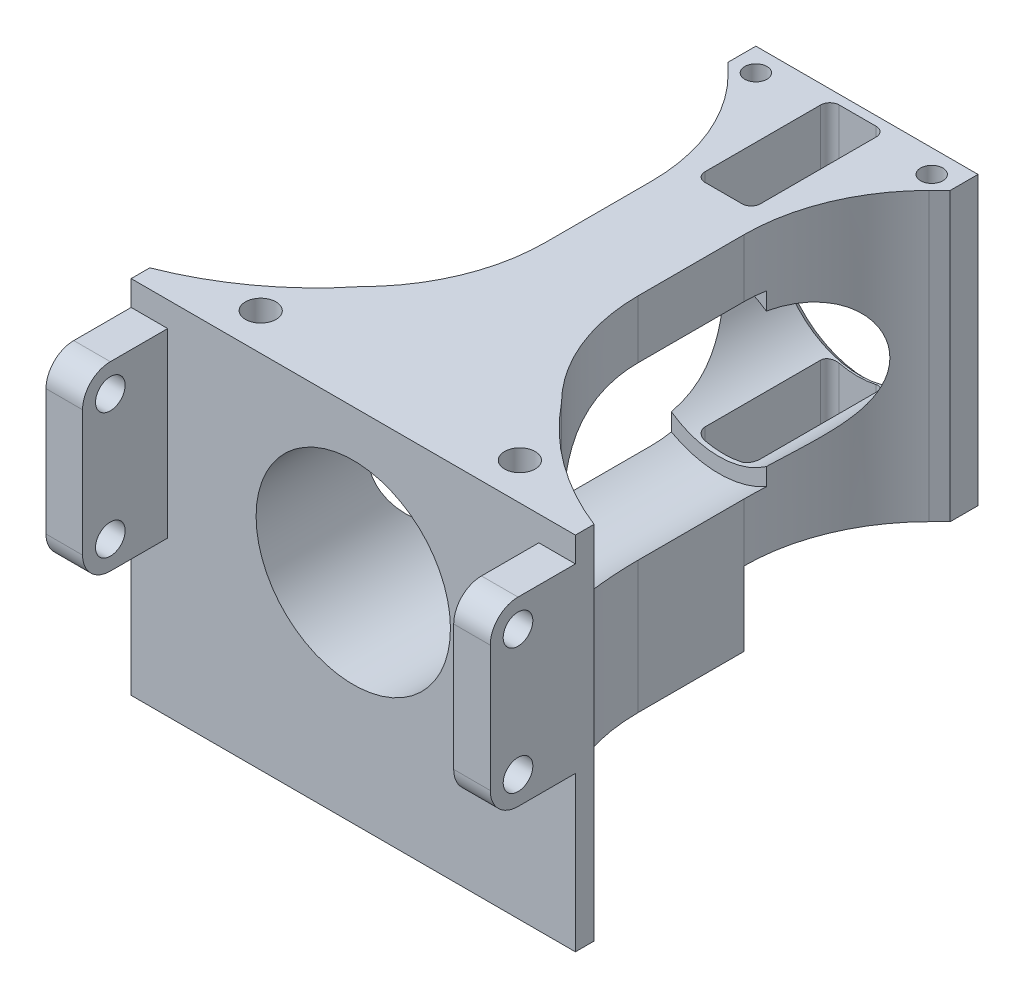
from build123d import *

# Parameters (mm, degrees)
SKETCH_1_W           = 48
SKETCH_1_H           = 31
SKETCH_1_R           = 8.9
EXTRUDE_1_DEPTH      = 65
SKETCH_2_R           = 10.5
CUT_EXTRUDE_1_DEPTH  = 49
CUT_EXTRUDE_3_DEPTH  = 76.907838857
CUT_EXTRUDE_START    = -31
CUT_EXTRUDE_5_DEPTH  = 107.907838984
SKETCH_9_R           = 1.2
CUT_EXTRUDE_6_DEPTH  = 7
CUT_EXTRUDE_START_2  = -24
SKETCH_9_2_R         = 1.2
CUT_EXTRUDE_7_DEPTH  = 7
EXTRUDE_4_DEPTH      = 8
SKETCH_11_R          = 1.65
CUT_EXTRUDE_9_DEPTH  = 80.511005658
SKETCH_14_R          = 1.65
CUT_EXTRUDE_10_DEPTH = 11
SKETCH_15_W          = 40.1
SKETCH_15_H          = 9.5
CUT_EXTRUDE_11_DEPTH = 80.511005658
SKETCH_17_R          = 1.6
CUT_EXTRUDE_13_DEPTH = 85.150163426
SKETCH_19_W          = 3
SKETCH_19_H          = 3
CUT_EXTRUDE_14_DEPTH = 76.651107105
CHAMFER_1_SIZE       = 0.8


with BuildPart() as part:
    # 草图1 → 凸台-拉伸1 (new body)
    with BuildSketch(Plane.XY):
        Rectangle(SKETCH_1_W, SKETCH_1_H)
        Circle(SKETCH_1_R, mode=Mode.SUBTRACT)
    extrude(amount=EXTRUDE_1_DEPTH)

    # 草图2 → 切除-拉伸1 (cut)
    with BuildSketch(Plane.XY.offset(65)):
        Circle(SKETCH_2_R)
    extrude(amount=-CUT_EXTRUDE_1_DEPTH, mode=Mode.SUBTRACT)

    # 草图4 → 切除-拉伸3 (cut, through all)
    with BuildSketch(Plane(origin=(0, 15.5, 0), x_dir=(1, 0, 0), z_dir=(0, 1, 0))):
        with BuildLine():
            Line((-24, 9), (-10.857864376, -4.142135624))
            ThreePointArc((-10.857864376, -4.142135624), (-6.52240935, -10.6306026), (-5, -18.284271247))
            Line((-5, -18.284271247), (-5, -29.715728753))
            ThreePointArc((-5, -29.715728753), (-6.52240935, -37.3693974), (-10.857864376, -43.857864376))
            ThreePointArc((-10.857864376, -43.857864376), (-16.798925034, -49.531146093), (-24, -53.484226727))
            Line((-24, -53.484226727), (-24, 9))
        make_face()
        with BuildLine():
            Line((5, -18.284271247), (5, -29.715728753))
            ThreePointArc((5, -29.715728753), (6.52240935, -37.3693974), (10.857864376, -43.857864376))
            ThreePointArc((10.857864376, -43.857864376), (16.798925034, -49.531146093), (24, -53.484226727))
            Line((24, -53.484226727), (24, 9))
            Line((24, 9), (10.857864376, -4.142135624))
            ThreePointArc((10.857864376, -4.142135624), (6.52240935, -10.6306026), (5, -18.284271247))
        make_face()
    extrude(amount=-CUT_EXTRUDE_3_DEPTH, mode=Mode.SUBTRACT)

    # 草图6 → 切除-拉伸5 (cut, through all)
    with BuildSketch(Plane(origin=(0, 15.5, 0), x_dir=(1, 0, 0), z_dir=(0, 1, 0)).offset(CUT_EXTRUDE_START)):
        with BuildLine():
            Line((-2, -1), (2, -1))
            ThreePointArc((2, -1), (2.707106781, -1.292893219), (3, -2))
            Line((3, -2), (3, -14.5))
            ThreePointArc((3, -14.5), (2.707106781, -15.207106781), (2, -15.5))
            Line((2, -15.5), (-2, -15.5))
            ThreePointArc((-2, -15.5), (-2.707106781, -15.207106781), (-3, -14.5))
            Line((-3, -14.5), (-3, -2))
            ThreePointArc((-3, -2), (-2.707106781, -1.292893219), (-2, -1))
        make_face()
    extrude(amount=CUT_EXTRUDE_5_DEPTH, mode=Mode.SUBTRACT)

    # 草图9 → 切除-拉伸6 (cut)
    with BuildSketch(Plane(origin=(0, 15.5, 0), x_dir=(1, 0, 0), z_dir=(0, 1, 0))):
        with Locations(Location((9.5, -2.5, 0), (0, 0, 270))):
            Circle(SKETCH_9_R)
        with Locations(Location((-9.5, -2.5, 0), (0, 0, 270))):
            Circle(SKETCH_9_R)
    extrude(amount=-CUT_EXTRUDE_6_DEPTH, mode=Mode.SUBTRACT)

    # 草图9<2> → 切除-拉伸7 (cut)
    with BuildSketch(Plane(origin=(0, 15.5, 0), x_dir=(1, 0, 0), z_dir=(0, 1, 0)).offset(CUT_EXTRUDE_START_2)):
        with Locations(Location((9.5, -2.5, 0), (0, 0, 270))):
            Circle(SKETCH_9_2_R)
        with Locations(Location((-9.5, -2.5, 0), (0, 0, 270))):
            Circle(SKETCH_9_2_R)
    extrude(amount=-CUT_EXTRUDE_7_DEPTH, mode=Mode.SUBTRACT)

    # 草图12 → 凸台-拉伸4 (add)
    with BuildSketch(Plane.XZ.offset(15.5)):
        with BuildLine():
            Line((-5, 18.284271247), (5, 18.284271247))
            Line((5, 18.284271247), (5, 29.715728753))
            ThreePointArc((5, 29.715728753), (6.52240935, 37.3693974), (10.857864376, 43.857864376))
            ThreePointArc((10.857864376, 43.857864376), (16.798925034, 49.531146093), (24, 53.484226727))
            Line((24, 53.484226727), (24, 65))
            Line((24, 65), (-24, 65))
            Line((-24, 65), (-24, 53.484226727))
            ThreePointArc((-24, 53.484226727), (-16.798925034, 49.531146093), (-10.857864376, 43.857864376))
            ThreePointArc((-10.857864376, 43.857864376), (-6.52240935, 37.3693974), (-5, 29.715728753))
            Line((-5, 29.715728753), (-5, 18.284271247))
        make_face()
    extrude(amount=EXTRUDE_4_DEPTH)

    # 草图11 → 切除-拉伸9 (cut, through all)
    with BuildSketch(Plane(origin=(0, 15.5, 0), x_dir=(1, 0, 0), z_dir=(0, 1, 0))):
        with Locations(Location((14, -51.5, 0), (0, 0, 270))):
            Circle(SKETCH_11_R)
        with Locations(Location((-14, -51.5, 0), (0, 0, 270))):
            Circle(SKETCH_11_R)
    extrude(amount=-CUT_EXTRUDE_9_DEPTH, mode=Mode.SUBTRACT)

    # 草图14 → 切除-拉伸10 (cut)
    with BuildSketch(Plane.XZ.offset(23.5)):
        with Locations(Location((0, 24, 0), (0, 0, 270))):
            Circle(SKETCH_14_R)
    extrude(amount=-CUT_EXTRUDE_10_DEPTH, mode=Mode.SUBTRACT)

    # 草图15 → 切除-拉伸11 (cut, through all)
    with BuildSketch(Plane(origin=(0, 15.5, 0), x_dir=(1, 0, 0), z_dir=(0, 1, 0))):
        with Locations((0, -60.25)):
            Rectangle(SKETCH_15_W, SKETCH_15_H)
    extrude(amount=-CUT_EXTRUDE_11_DEPTH, mode=Mode.SUBTRACT)

    # 草图17 → 切除-拉伸13 (cut, through all)
    with BuildSketch(Plane(origin=(24, 0, 0), x_dir=(0, 0, -1), z_dir=(1, 0, 0))):
        with Locations((-61.7, 9.8)):
            Circle(SKETCH_17_R)
        with Locations((-61.7, -3.8)):
            Circle(SKETCH_17_R)
        with BuildLine():
            Line((-55.5, -23.5), (-55.5, -6.8))
            Line((-55.5, -6.8), (-61.7, -6.8))
            ThreePointArc((-61.7, -6.8), (-63.821320344, -5.921320344), (-64.7, -3.8))
            Line((-64.7, -3.8), (-64.7, 9.8))
            ThreePointArc((-64.7, 9.8), (-63.821320344, 11.921320344), (-61.7, 12.8))
            Line((-61.7, 12.8), (-55.5, 12.8))
            Line((-55.5, 12.8), (-55.5, 15.5))
            Line((-55.5, 15.5), (-64.7, 15.5))
            Line((-64.7, 15.5), (-94.5, 15.5))
            Line((-94.5, 15.5), (-94.5, -23.5))
            Line((-94.5, -23.5), (-55.5, -23.5))
        make_face()
    extrude(amount=-CUT_EXTRUDE_13_DEPTH, mode=Mode.SUBTRACT)

    # 草图19 → 切除-拉伸14 (cut, through all)
    with BuildSketch(Plane.XZ.offset(15.5)):
        with Locations((-13.5, 1.5)):
            Rectangle(SKETCH_19_W, SKETCH_19_H)
        with Locations((13.5, 1.5)):
            Rectangle(SKETCH_19_W, SKETCH_19_H)
    extrude(amount=-CUT_EXTRUDE_14_DEPTH, mode=Mode.SUBTRACT)

    # 倒角1
    chamfer_1_edges = [part.edges().sort_by_distance(p)[0] for p in [
        (-8.9, 0, 0),
    ]]
    chamfer(chamfer_1_edges, length=CHAMFER_1_SIZE)


solid = part.part
